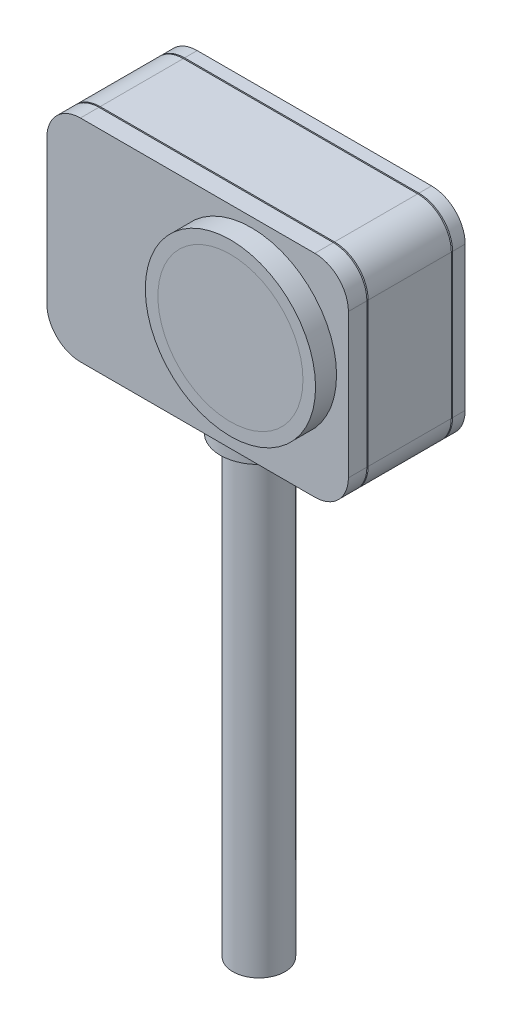
from build123d import *

# Parameters (mm, degrees)
BOSS_EXTRUDE3_DEPTH  = 3
BOSS_EXTRUDE4_DEPTH  = 0.3
BOSS_EXTRUDE5_DEPTH  = 19.8
BOSS_EXTRUDE6_DEPTH  = 0.3
BOSS_EXTRUDE7_DEPTH  = 4.4
SKETCH19_R           = 9.20625279
BOSS_EXTRUDE11_DEPTH = 8
SKETCH20_R           = 6.20625279
BOSS_EXTRUDE12_DEPTH = 108
SKETCH21_R           = 20.269072442
BOSS_EXTRUDE13_DEPTH = 5
SKETCH23_R           = 17.269072442
CUT_EXTRUDE2_DEPTH   = 1
CUT_EXTRUDE3_DEPTH   = 1
SKETCH25_R           = 9.506960847
CUT_EXTRUDE4_DEPTH   = 1
SKETCH29_R           = 17.269072442
BOSS_EXTRUDE14_DEPTH = 0.2
SCALE1_SCALE         = 0.278551532
SKETCH31_R           = 0.75
BOSS_EXTRUDE15_DEPTH = 0.5


with BuildPart() as part:
    # Sketch3 → Boss-Extrude3 (new body)
    with BuildSketch(Plane.XY):
        with BuildLine():
            Line((-27.9, 25.15), (27.9, 25.15))
            ThreePointArc((27.9, 25.15), (33.556854249, 22.806854249), (35.9, 17.15))
            Line((35.9, 17.15), (35.9, -17.15))
            ThreePointArc((35.9, -17.15), (33.556854249, -22.806854249), (27.9, -25.15))
            Line((27.9, -25.15), (-27.9, -25.15))
            ThreePointArc((-27.9, -25.15), (-33.556854249, -22.806854249), (-35.9, -17.15))
            Line((-35.9, -17.15), (-35.9, 17.15))
            ThreePointArc((-35.9, 17.15), (-33.556854249, 22.806854249), (-27.9, 25.15))
        make_face()
    extrude(amount=BOSS_EXTRUDE3_DEPTH)

    # Sketch4 → Boss-Extrude4 (add)
    with BuildSketch(Plane.XY.offset(3)):
        with BuildLine():
            Line((27.9, 24.65), (-27.9, 24.65))
            ThreePointArc((-27.9, 24.65), (-33.203300859, 22.453300859), (-35.4, 17.15))
            Line((-35.4, 17.15), (-35.4, -17.15))
            ThreePointArc((-35.4, -17.15), (-33.203300859, -22.453300859), (-27.9, -24.65))
            Line((-27.9, -24.65), (27.9, -24.65))
            ThreePointArc((27.9, -24.65), (33.203300859, -22.453300859), (35.4, -17.15))
            Line((35.4, -17.15), (35.4, 17.15))
            ThreePointArc((35.4, 17.15), (33.203300859, 22.453300859), (27.9, 24.65))
        make_face()
    extrude(amount=BOSS_EXTRUDE4_DEPTH)

    # Sketch5 → Boss-Extrude5 (add)
    with BuildSketch(Plane.XY.offset(3.3)):
        with BuildLine():
            Line((27.9, 25.15), (-27.9, 25.15))
            ThreePointArc((-27.9, 25.15), (-33.556854249, 22.806854249), (-35.9, 17.15))
            Line((-35.9, 17.15), (-35.9, -17.15))
            ThreePointArc((-35.9, -17.15), (-33.556854249, -22.806854249), (-27.9, -25.15))
            Line((-27.9, -25.15), (27.9, -25.15))
            ThreePointArc((27.9, -25.15), (33.556854249, -22.806854249), (35.9, -17.15))
            Line((35.9, -17.15), (35.9, 17.15))
            ThreePointArc((35.9, 17.15), (33.556854249, 22.806854249), (27.9, 25.15))
        make_face()
    extrude(amount=BOSS_EXTRUDE5_DEPTH)

    # Sketch6 → Boss-Extrude6 (add)
    with BuildSketch(Plane.XY.offset(23.1)):
        with BuildLine():
            Line((27.9, 24.65), (-27.9, 24.65))
            ThreePointArc((-27.9, 24.65), (-33.203300859, 22.453300859), (-35.4, 17.15))
            Line((-35.4, 17.15), (-35.4, -17.15))
            ThreePointArc((-35.4, -17.15), (-33.203300859, -22.453300859), (-27.9, -24.65))
            Line((-27.9, -24.65), (27.9, -24.65))
            ThreePointArc((27.9, -24.65), (33.203300859, -22.453300859), (35.4, -17.15))
            Line((35.4, -17.15), (35.4, 17.15))
            ThreePointArc((35.4, 17.15), (33.203300859, 22.453300859), (27.9, 24.65))
        make_face()
    extrude(amount=BOSS_EXTRUDE6_DEPTH)

    # Sketch7 → Boss-Extrude7 (add)
    with BuildSketch(Plane.XY.offset(23.4)):
        with BuildLine():
            Line((27.9, 25.15), (-27.9, 25.15))
            ThreePointArc((-27.9, 25.15), (-33.556854249, 22.806854249), (-35.9, 17.15))
            Line((-35.9, 17.15), (-35.9, -17.15))
            ThreePointArc((-35.9, -17.15), (-33.556854249, -22.806854249), (-27.9, -25.15))
            Line((-27.9, -25.15), (27.9, -25.15))
            ThreePointArc((27.9, -25.15), (33.556854249, -22.806854249), (35.9, -17.15))
            Line((35.9, -17.15), (35.9, 17.15))
            ThreePointArc((35.9, 17.15), (33.556854249, 22.806854249), (27.9, 25.15))
        make_face()
    extrude(amount=BOSS_EXTRUDE7_DEPTH)

    # Sketch19 → Boss-Extrude11 (add)
    with BuildSketch(Plane.XZ.offset(25.15)):
        with Locations(Location((0, 13.2, 0), (0, 0, 90))):
            Circle(SKETCH19_R)
    extrude(amount=BOSS_EXTRUDE11_DEPTH)

    # Sketch20 → Boss-Extrude12 (add)
    with BuildSketch(Plane.XZ.offset(33.15)):
        with Locations(Location((0, 13.2, 0), (0, 0, 270))):
            Circle(SKETCH20_R)
    extrude(amount=BOSS_EXTRUDE12_DEPTH)

    # Sketch21 → Boss-Extrude13 (add)
    with BuildSketch(Plane.XY.offset(27.8)):
        with Locations((12.81148727, 2.628569179)):
            Circle(SKETCH21_R)
    extrude(amount=BOSS_EXTRUDE13_DEPTH)

    # Sketch23 → Cut-Extrude2 (cut)
    with BuildSketch(Plane.XY.offset(32.8)):
        with Locations((12.81148727, 2.628569179)):
            Circle(SKETCH23_R)
    extrude(amount=-CUT_EXTRUDE2_DEPTH, mode=Mode.SUBTRACT)

    # Sketch24 → Cut-Extrude3 (cut)
    with BuildSketch(Plane.XY.offset(31.8)):
        with BuildLine():
            Line((4.767177469, 12.619958082), (20.85579707, 12.619958082))
            ThreePointArc((20.85579707, 12.619958082), (24.391330976, 11.155491987), (25.85579707, 7.619958082))
            Line((25.85579707, 7.619958082), (25.85579707, -2.362819723))
            ThreePointArc((25.85579707, -2.362819723), (24.391330976, -5.898353629), (20.85579707, -7.362819723))
            Line((20.85579707, -7.362819723), (4.767177469, -7.362819723))
            ThreePointArc((4.767177469, -7.362819723), (1.231643563, -5.898353629), (-0.232822531, -2.362819723))
            Line((-0.232822531, -2.362819723), (-0.232822531, 7.619958082))
            ThreePointArc((-0.232822531, 7.619958082), (1.231643563, 11.155491987), (4.767177469, 12.619958082))
        make_face()
    extrude(amount=-CUT_EXTRUDE3_DEPTH, mode=Mode.SUBTRACT)

    # Sketch25 → Cut-Extrude4 (cut)
    with BuildSketch(Plane.XY.offset(30.8)):
        with Locations((12.81148727, 2.628569179)):
            Circle(SKETCH25_R)
    extrude(amount=-CUT_EXTRUDE4_DEPTH, mode=Mode.SUBTRACT)


with BuildPart() as body_2:
    # Sketch29 → Boss-Extrude14 (new body)
    with BuildSketch(Plane.XY.offset(32.8)):
        with Locations((12.81148727, 2.628569179)):
            Circle(SKETCH29_R)
    extrude(amount=-BOSS_EXTRUDE14_DEPTH)


with BuildPart() as body_2_1:
    # Scale1: scaled about (0, 0, 0)
    add(body_2.part.scale(SCALE1_SCALE))


with BuildPart() as part_1:
    # Scale1: scaled about (0, 0, 0)
    add(part.part.scale(SCALE1_SCALE))

    # Sketch31 → Boss-Extrude15 (add)
    with BuildSketch(Plane.XZ.offset(39.317548742)):
        with Locations(Location((0, 3.676880222, 0), (0, 0, 270))):
            Circle(SKETCH31_R)
    extrude(amount=BOSS_EXTRUDE15_DEPTH)


solid = Compound([body_2_1.part, part_1.part])
